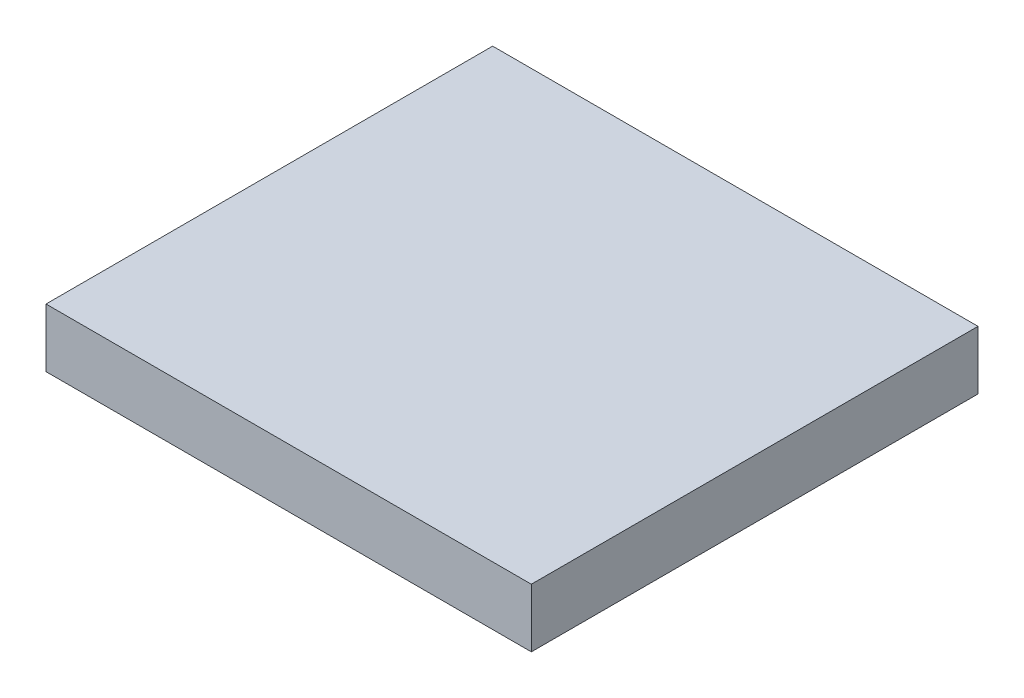
from build123d import *

# Parameters (mm, degrees)
SKETCH_1_W      = 2070
SKETCH_1_H      = 1905
EXTRUDE_1_DEPTH = 249.91241198


with BuildPart() as part:
    # 草图1 → 凸台-拉伸1 (new body)
    with BuildSketch(Plane(origin=(0, 0, 0), x_dir=(1, 0, 0), z_dir=(0, 1, 0))):
        with Locations((1035, 952.5)):
            Rectangle(SKETCH_1_W, SKETCH_1_H)
    extrude(amount=EXTRUDE_1_DEPTH)


solid = part.part
